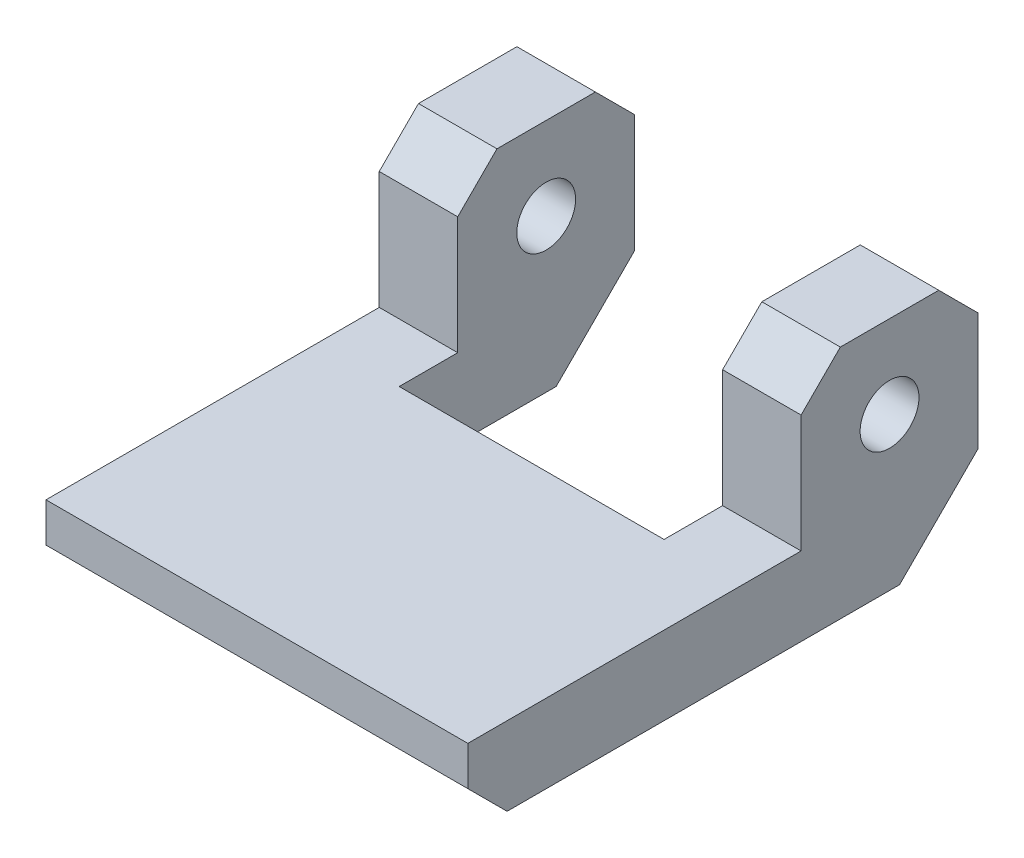
from build123d import *

# Parameters (mm, degrees)
SKETCH_1_W          = 21.5
SKETCH_1_H          = 26
EXTRUDE_1_DEPTH     = 12
SKETCH_2_W          = 22.422219076
SKETCH_2_H          = 9.017669608
CUT_EXTRUDE_1_DEPTH = 36.80851854
CHAMFER_1_SIZE      = 2
CHAMFER_2_SIZE      = 4
SKETCH_3_R          = 1.5
CUT_EXTRUDE_2_DEPTH = 36.80851854
SKETCH_4_W          = 13.5
SKETCH_4_H          = 18.032522109
CUT_EXTRUDE_3_DEPTH = 36.80851854
CHAMFER_3_SIZE      = 2


with BuildPart() as part:
    # Эскиз1 → Вытянуть1 (new body)
    with BuildSketch(Plane(origin=(0, 0, 0), x_dir=(1, 0, 0), z_dir=(0, 1, 0))):
        with Locations((10.75, -13)):
            Rectangle(SKETCH_1_W, SKETCH_1_H)
    extrude(amount=EXTRUDE_1_DEPTH)

    # Эскиз2 → Вырез-Вытянуть1 (cut, through all)
    with BuildSketch(Plane(origin=(21.5, 0, 0), x_dir=(0, 0, -1), z_dir=(1, 0, 0))):
        with Locations((-20.227370593, 8.508834804)):
            Rectangle(SKETCH_2_W, SKETCH_2_H)
    extrude(amount=-CUT_EXTRUDE_1_DEPTH, mode=Mode.SUBTRACT)

    # Фаска1
    chamfer_1_edges = [part.edges().sort_by_distance(p)[0] for p in [
        (10.75, 12, 0),
        (10.75, 12, 9.016261055),
    ]]
    chamfer(chamfer_1_edges, length=CHAMFER_1_SIZE)

    # Фаска2
    chamfer_2_edges = [part.edges().sort_by_distance(p)[0] for p in [
        (10.75, 0, 0),
    ]]
    chamfer(chamfer_2_edges, length=CHAMFER_2_SIZE)

    # Эскиз3 → Вырез-Вытянуть2 (cut, through all)
    with BuildSketch(Plane(origin=(21.5, 0, 0), x_dir=(0, 0, -1), z_dir=(1, 0, 0))):
        with Locations((-4.508130527, 7.777054312)):
            Circle(SKETCH_3_R)
    extrude(amount=-CUT_EXTRUDE_2_DEPTH, mode=Mode.SUBTRACT)

    # Эскиз4 → Вырез-Вытянуть3 (cut, through all)
    with BuildSketch(Plane(origin=(0, 12, 0), x_dir=(1, 0, 0), z_dir=(0, 1, 0))):
        with Locations((10.75, -2.983738945)):
            Rectangle(SKETCH_4_W, SKETCH_4_H)
    extrude(amount=-CUT_EXTRUDE_3_DEPTH, mode=Mode.SUBTRACT)

    # Фаска3
    chamfer_3_edges = [part.edges().sort_by_distance(p)[0] for p in [
        (10.75, 0, 26),
    ]]
    chamfer(chamfer_3_edges, length=CHAMFER_3_SIZE)


solid = part.part
